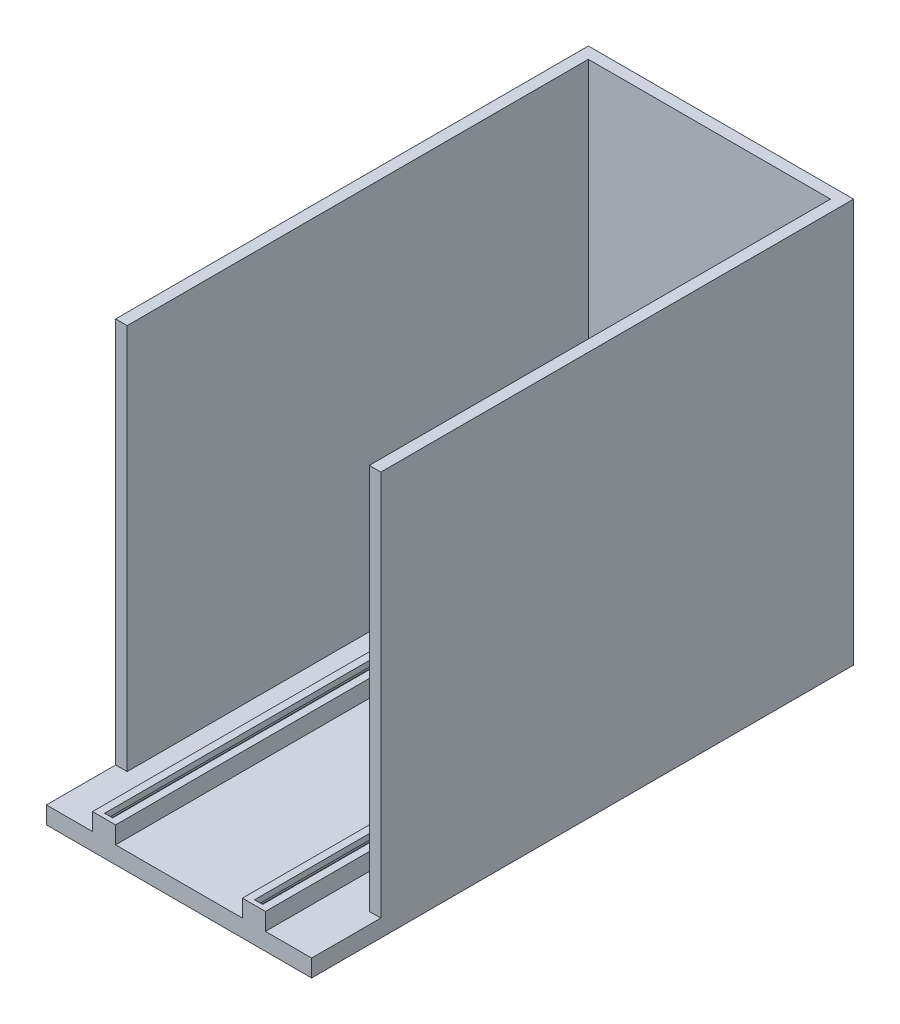
from build123d import *

# Parameters (mm, degrees)
SKETCH1_W               = 292.1
SKETCH1_H               = 596.9
BOSS_EXTRUDE1_DEPTH     = 19.05
BOSS_EXTRUDE2_DEPTH     = 425.45
SKETCH3_W               = 25.4
SKETCH3_H               = 508
BOSS_EXTRUDE3_DEPTH     = 7.62
SKETCH4_W               = 25.4
SKETCH4_H               = 508
SKETCH4_W_2             = 15.24
SKETCH4_H_2             = 497.84
BOSS_EXTRUDE4_DEPTH     = 11.43
SKETCH5_W               = 497.84
SKETCH5_H               = 6.35
BOSS_EXTRUDE5_DEPTH     = 3.175
MIRROR2_COPY_1_SKETCH_W = 497.84
MIRROR2_COPY_1_SKETCH_H = 6.35
MIRROR2_COPY_1_DEPTH    = 3.175


with BuildPart() as part:
    # Sketch1 → Boss-Extrude1 (new body)
    with BuildSketch(Plane(origin=(0, 0, 0), x_dir=(1, 0, 0), z_dir=(0, 1, 0))):
        Rectangle(SKETCH1_W, SKETCH1_H)
    boss_extrude1 = extrude(amount=BOSS_EXTRUDE1_DEPTH)

    # Sketch2 → Boss-Extrude2 (add)
    with BuildSketch(Plane(origin=(0, 19.05, 0), x_dir=(1, 0, 0), z_dir=(0, 1, 0))):
        Polygon((-146.05, -222.25), (-146.05, 298.45), (146.05, 298.45), (146.05, -222.25), (133.35, -222.25), (133.35, 285.75), (-133.35, 285.75), (-133.35, -222.25), align=None)
    extrude(amount=BOSS_EXTRUDE2_DEPTH)

    # Sketch3 → Boss-Extrude3 (add)
    with BuildSketch(Plane(origin=(0, 19.05, 0), x_dir=(1, 0, 0), z_dir=(0, 1, 0))):
        with Locations((-82.55, -44.45)):
            Rectangle(SKETCH3_W, SKETCH3_H)
    boss_extrude3 = extrude(amount=BOSS_EXTRUDE3_DEPTH)

    # Sketch4 → Boss-Extrude4 (add)
    with BuildSketch(Plane(origin=(0, 26.67, 0), x_dir=(1, 0, 0), z_dir=(0, 1, 0))):
        with Locations((-82.55, -44.45)):
            Rectangle(SKETCH4_W, SKETCH4_H)
        with Locations((-82.55, -44.45)):
            Rectangle(SKETCH4_W_2, SKETCH4_H_2, mode=Mode.SUBTRACT)
    boss_extrude4 = extrude(amount=BOSS_EXTRUDE4_DEPTH)

    # Sketch5 → Boss-Extrude5 (add)
    with BuildSketch(Plane(origin=(-90.17, 0, 0), x_dir=(0, 0, -1), z_dir=(1, 0, 0))):
        with Locations((-44.45, 34.925)):
            Rectangle(SKETCH5_W, SKETCH5_H)
    boss_extrude5 = extrude(amount=BOSS_EXTRUDE5_DEPTH)

    # Mirror1: Boss-Extrude5 across plane
    add(boss_extrude5.mirror(Plane(origin=(-82.55, 0, 0), x_dir=(0, 0, 1), z_dir=(1, 0, 0))))

    # Mirror2: Boss-Extrude1, Boss-Extrude3, Boss-Extrude4, Boss-Extrude5 across plane
    add(boss_extrude1.mirror(Plane(origin=(0, 0, 0), x_dir=(0, 0, 1), z_dir=(1, 0, 0))))
    add(boss_extrude3.mirror(Plane(origin=(0, 0, 0), x_dir=(0, 0, 1), z_dir=(1, 0, 0))))
    add(boss_extrude4.mirror(Plane(origin=(0, 0, 0), x_dir=(0, 0, 1), z_dir=(1, 0, 0))))
    add(boss_extrude5.mirror(Plane(origin=(0, 0, 0), x_dir=(0, 0, 1), z_dir=(1, 0, 0))))

    # Mirror2 copy 1 sketch → Mirror2 copy 1 (add)
    with BuildSketch(Plane(origin=(74.93, 0, 0), x_dir=(0, 0, -1), z_dir=(1, 0, 0))):
        with Locations((-44.45, 34.925)):
            Rectangle(MIRROR2_COPY_1_SKETCH_W, MIRROR2_COPY_1_SKETCH_H)
    extrude(amount=MIRROR2_COPY_1_DEPTH)


solid = part.part
